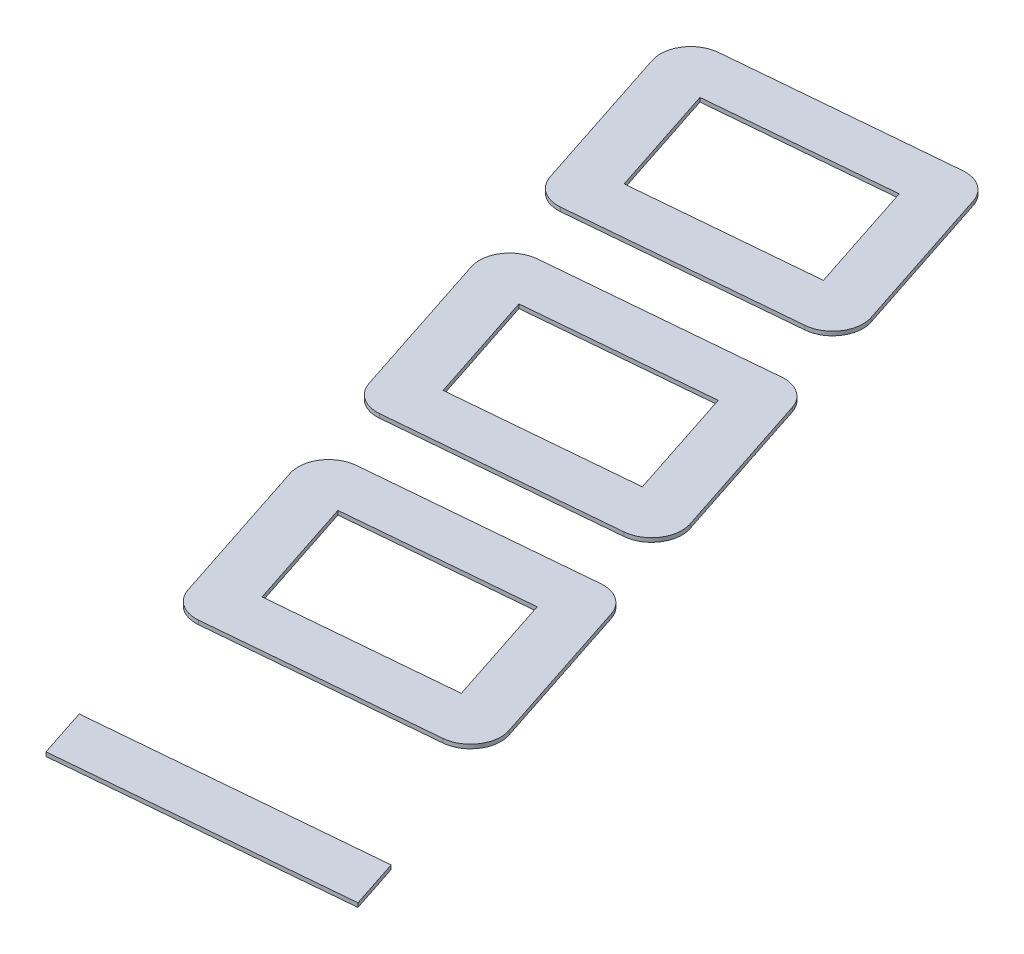
from build123d import *

# Parameters (mm, degrees)
BOSS_EXTRUDE1_DEPTH   = 0.1
BOSS_EXTRUDE1_2_DEPTH = 0.1
BOSS_EXTRUDE1_3_DEPTH = 0.1
BOSS_EXTRUDE1_4_DEPTH = 0.1


with BuildPart() as part:
    # Sketch1 → Boss-Extrude1 (new body)
    with BuildSketch(Plane(origin=(0, 0, 0), x_dir=(1, 0, 0), z_dir=(0, 1, 0))):
        with BuildLine():
            Line((24.814936785, -40.243096001), (30.360245664, -39.754754547))
            ThreePointArc((30.360245664, -39.754754547), (30.838979213, -39.875779803), (31.138711106, -40.268200133))
            Line((31.138711106, -40.268200133), (32.372388114, -44.03091501))
            ThreePointArc((32.372388114, -44.03091501), (32.285799291, -44.677518274), (31.725509245, -45.0116866))
            Line((31.725509245, -45.0116866), (26.180200366, -45.500028055))
            ThreePointArc((26.180200366, -45.500028055), (25.701466817, -45.379002798), (25.401734924, -44.986582468))
            Line((25.401734924, -44.986582468), (24.168057915, -41.223867592))
            ThreePointArc((24.168057915, -41.223867592), (24.254646739, -40.577264327), (24.814936785, -40.243096001))
        make_face()
        Polygon((25.55210278, -41.433015967), (30.074567356, -41.034750158), (30.98834325, -43.821766634), (26.465878674, -44.220032443), align=None, mode=Mode.SUBTRACT)
    extrude(amount=BOSS_EXTRUDE1_DEPTH)


with BuildPart() as body_2:
    # Sketch1 → Boss-Extrude1 2 (new body)
    with BuildSketch(Plane(origin=(0, 0, 0), x_dir=(1, 0, 0), z_dir=(0, 1, 0))):
        with BuildLine():
            Line((26.995791469, -46.894702788), (32.541100348, -46.406361333))
            ThreePointArc((32.541100348, -46.406361333), (33.019833897, -46.52738659), (33.31956579, -46.91980692))
            Line((33.31956579, -46.91980692), (34.553242798, -50.682521796))
            ThreePointArc((34.553242798, -50.682521796), (34.466653975, -51.329125061), (33.906363929, -51.663293387))
            Line((33.906363929, -51.663293387), (28.36105505, -52.151634841))
            ThreePointArc((28.36105505, -52.151634841), (27.882321501, -52.030609585), (27.582589608, -51.638189254))
            Line((27.582589608, -51.638189254), (26.3489126, -47.875474378))
            ThreePointArc((26.3489126, -47.875474378), (26.435501423, -47.228871114), (26.995791469, -46.894702788))
        make_face()
        Polygon((27.732957464, -48.084622754), (32.25542204, -47.686356944), (33.169197934, -50.473373421), (28.646733358, -50.87163923), align=None, mode=Mode.SUBTRACT)
    extrude(amount=BOSS_EXTRUDE1_2_DEPTH)


with BuildPart() as body_3:
    # Sketch1 → Boss-Extrude1 3 (new body)
    with BuildSketch(Plane(origin=(0, 0, 0), x_dir=(1, 0, 0), z_dir=(0, 1, 0))):
        with BuildLine():
            Line((22.634082101, -33.591489214), (28.179390979, -33.10314776))
            ThreePointArc((28.179390979, -33.10314776), (28.658124528, -33.224173016), (28.957856421, -33.616593347))
            Line((28.957856421, -33.616593347), (30.19153343, -37.379308223))
            ThreePointArc((30.19153343, -37.379308223), (30.104944607, -38.025911487), (29.544654561, -38.360079813))
            Line((29.544654561, -38.360079813), (23.999345682, -38.848421268))
            ThreePointArc((23.999345682, -38.848421268), (23.520612133, -38.727396012), (23.22088024, -38.334975681))
            Line((23.22088024, -38.334975681), (21.987203231, -34.572260805))
            ThreePointArc((21.987203231, -34.572260805), (22.073792054, -33.92565754), (22.634082101, -33.591489214))
        make_face()
        Polygon((23.371248096, -34.78140918), (27.893712672, -34.383143371), (28.807488565, -37.170159847), (24.28502399, -37.568425657), align=None, mode=Mode.SUBTRACT)
    extrude(amount=BOSS_EXTRUDE1_3_DEPTH)


with BuildPart() as body_4:
    # Sketch1 → Boss-Extrude1 4 (new body)
    with BuildSketch(Plane(origin=(0, 0, 0), x_dir=(1, 0, 0), z_dir=(0, 1, 0))):
        Polygon((28.89220652, -55.632520835), (29.292082913, -56.852143835), (36.371658246, -56.228688913), (35.971781853, -55.009065913), align=None)
    extrude(amount=BOSS_EXTRUDE1_4_DEPTH)


solid = Compound([part.part, body_2.part, body_3.part, body_4.part])
